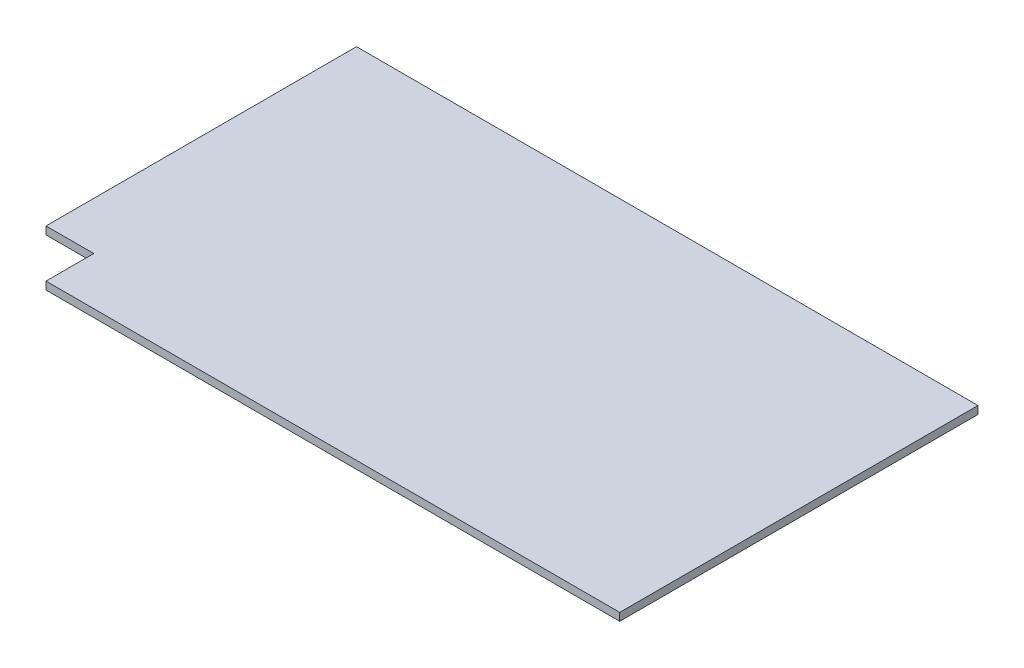
from build123d import *

# Parameters (mm, degrees)
SKETCH1_W                   = 1500
SKETCH1_H                   = 2500
PLACA_BASE_PAVIMENTO_DEPTH  = 15
CORTE_PARA_PLACA_BASE_DEPTH = 1458.815146032
SKETCH7_W                   = 1197
SKETCH7_H                   = 1710
PLACA_BASE_RESTO_DEPTH      = 1458.815146032
SKETCH3_W                   = 92
SKETCH3_H                   = 92
CANTO_ESQUERDO_DEPTH        = 1458.815146032


with BuildPart() as part:
    # Sketch1 → Placa Base Pavimento (new body)
    with BuildSketch(Plane(origin=(0, 0, 0), x_dir=(1, 0, 0), z_dir=(0, 1, 0))):
        Rectangle(SKETCH1_W, SKETCH1_H)
    extrude(amount=PLACA_BASE_PAVIMENTO_DEPTH)

    # Sketch2 → Corte Para Placa Base (cut, through all)
    with BuildSketch(Plane(origin=(0, 15, 0), x_dir=(1, 0, 0), z_dir=(0, 1, 0))):
        Polygon((-750, 1150), (447, 1150), (447, -1250), (750, -1250), (750, 1250), (-750, 1250), align=None)
    extrude(amount=-CORTE_PARA_PLACA_BASE_DEPTH, mode=Mode.SUBTRACT)

    # Sketch7 → Placa Base Resto (cut, through all)
    with BuildSketch(Plane(origin=(0, 15, 0), x_dir=(1, 0, 0), z_dir=(0, 1, 0))):
        with Locations((-151.5, 295)):
            Rectangle(SKETCH7_W, SKETCH7_H)
    extrude(amount=-PLACA_BASE_RESTO_DEPTH, mode=Mode.SUBTRACT)

    # Sketch3 → Canto Esquerdo (cut, through all)
    with BuildSketch(Plane(origin=(0, 15, 0), x_dir=(1, 0, 0), z_dir=(0, 1, 0))):
        with Locations((-704, -1204)):
            Rectangle(SKETCH3_W, SKETCH3_H)
    extrude(amount=-CANTO_ESQUERDO_DEPTH, mode=Mode.SUBTRACT)


solid = part.part
